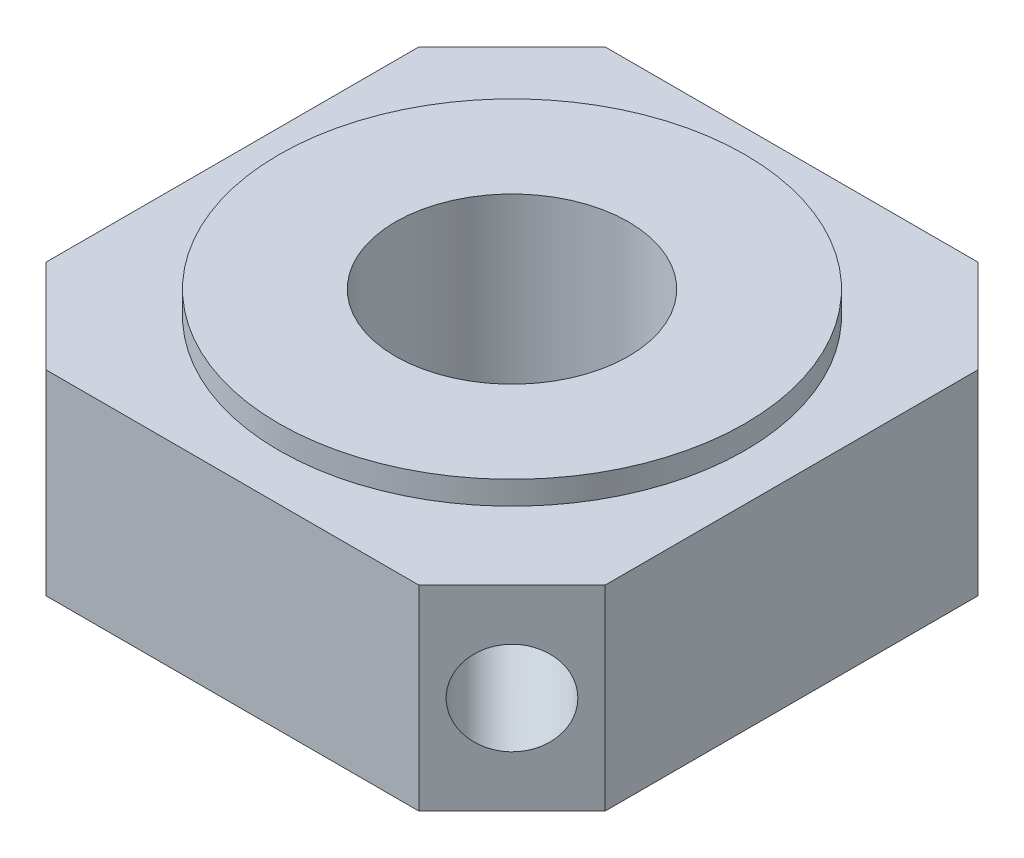
from build123d import *

# Parameters (mm, degrees)
BOSS_EXTRUDE1_DEPTH     = 4.2
SKETCH3_R               = 5
BOSS_EXTRUDE2_DEPTH     = 0.5
CUT_EXTRUDE1_REACH      = 11.7
SKETCH4_R               = 2.5
CUT_EXTRUDE2_REACH      = 18.251
CUT_EXTRUDE2_END_RADIUS = 2.5
SKETCH5_R               = 1


with BuildPart() as part:
    # Sketch1 → Boss-Extrude1 (new body)
    with BuildSketch(Plane(origin=(0, 0, 0), x_dir=(1, 0, 0), z_dir=(0, 1, 0))):
        Polygon((-4, 6), (-6, 4), (-6, -4), (-4, -6), (4, -6), (6, -4), (6, 4), (4, 6), align=None)
    extrude(amount=BOSS_EXTRUDE1_DEPTH)

    # Sketch3 → Boss-Extrude2 (add)
    with BuildSketch(Plane(origin=(0, 4.2, 0), x_dir=(1, 0, 0), z_dir=(0, 1, 0))):
        with Locations(Location((0, 0, 0), (0, 0, 270))):
            Circle(SKETCH3_R)
    extrude(amount=BOSS_EXTRUDE2_DEPTH)

    # Sketch4 → Cut-Extrude1 (cut, up to next)
    with BuildSketch(Plane(origin=(0, 4.7, 0), x_dir=(1, 0, 0), z_dir=(0, 1, 0)), mode=Mode.PRIVATE) as cut_extrude1_sk1:
        with Locations(Location((0, 0, 0), (0, 0, 270))):
            Circle(SKETCH4_R)
    cut_extrude1_tool1 = extrude(cut_extrude1_sk1.sketch, amount=-CUT_EXTRUDE1_REACH, mode=Mode.PRIVATE) & part.part
    add(cut_extrude1_tool1.solids().sort_by_distance((0, 4.7, 0))[0], mode=Mode.SUBTRACT)

    # Cut-Extrude2: up to this cylinder (the profile starts outside it)
    cut_extrude2_end = Plane(origin=(0, 2.1, 0), z_dir=(0, 1, 0)) * Cylinder(CUT_EXTRUDE2_END_RADIUS, 42.502, mode=Mode.PRIVATE)
    # Sketch5 → Cut-Extrude2 (cut, up to the surface)
    with BuildSketch(Plane(origin=(5, 0, 5), x_dir=(0.7071067811865481, 0, -0.7071067811865469), z_dir=(0.7071067811865469, 0, 0.7071067811865481)), mode=Mode.PRIVATE) as cut_extrude2_sk1:
        with Locations((0, 2.1)):
            Circle(SKETCH5_R)
    cut_extrude2_tool1 = extrude(cut_extrude2_sk1.sketch, amount=-CUT_EXTRUDE2_REACH, mode=Mode.PRIVATE) - cut_extrude2_end
    add(cut_extrude2_tool1.solids().sort_by_distance((5, 2.1, 5))[0], mode=Mode.SUBTRACT)


solid = part.part
